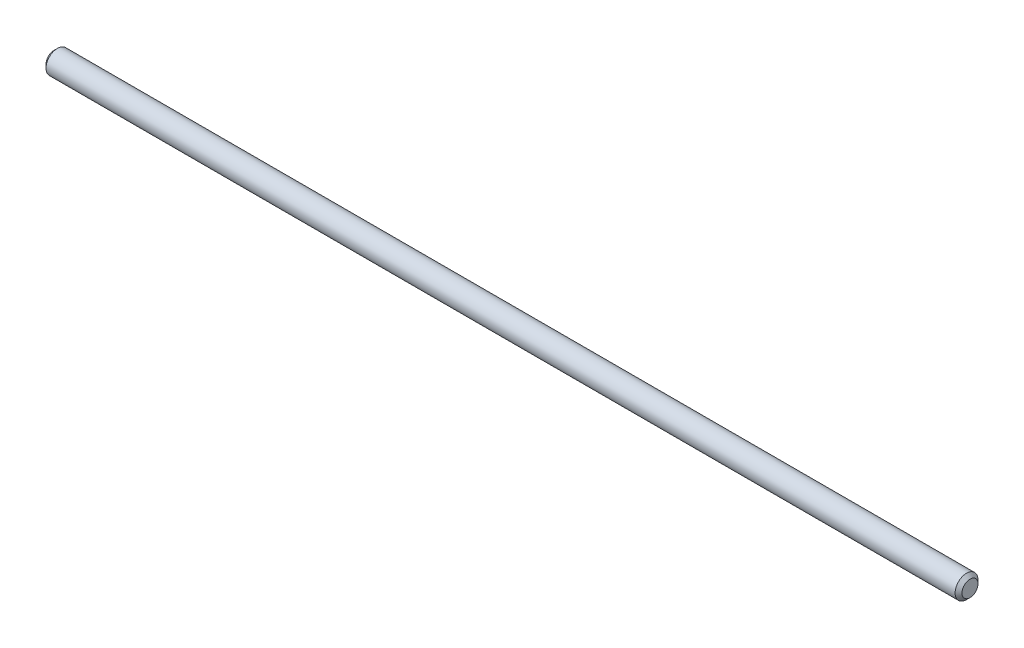
from build123d import *

# Parameters (mm, degrees)
BOSS_EXTRUDE1_DEPTH      = 127
BOSS_EXTRUDE1_DEPTH_BACK = 127
SKETCH2_R                = 3.175
CHAMFER1_SIZE            = 0.9525


with BuildPart() as part:
    # Sketch2 → Boss-Extrude1 (new, two sides: drawn at the far end of the back side and taken through both)
    with BuildSketch(Plane(origin=(0, 0, 0), x_dir=(0, 0, -1), z_dir=(1, 0, 0)).offset(-BOSS_EXTRUDE1_DEPTH_BACK)):
        Circle(SKETCH2_R)
    extrude(amount=BOSS_EXTRUDE1_DEPTH + BOSS_EXTRUDE1_DEPTH_BACK)

    # Chamfer1
    chamfer1_edges = [part.edges().sort_by_distance(p)[0] for p in [
        (-127, 0, 3.175),
        (127, 0, 3.175),
    ]]
    chamfer(chamfer1_edges, length=CHAMFER1_SIZE)


solid = part.part
